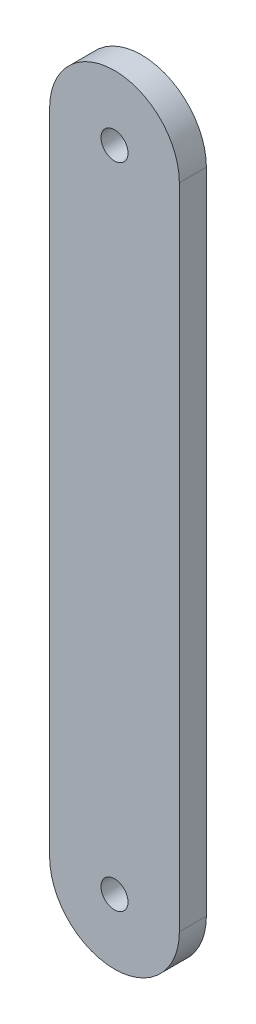
from build123d import *

# Parameters (mm, degrees)
SKETCH_1_R      = 2.5
EXTRUDE_1_DEPTH = 5


with BuildPart() as part:
    # 草图1 → 凸台-拉伸1 (new body)
    with BuildSketch(Plane.XY.offset(5)):
        with BuildLine():
            Line((12, -60), (12, 60))
            ThreePointArc((12, 60), (0, 72), (-12, 60))
            Line((-12, 60), (-12, -60))
            ThreePointArc((-12, -60), (0, -72), (12, -60))
        make_face()
        with Locations(Location((0, -60, 0), (0, 0, 180))):
            Circle(SKETCH_1_R, mode=Mode.SUBTRACT)
        with Locations(Location((0, 60, 0), (0, 0, 180))):
            Circle(SKETCH_1_R, mode=Mode.SUBTRACT)
    extrude(amount=-EXTRUDE_1_DEPTH)


solid = part.part
